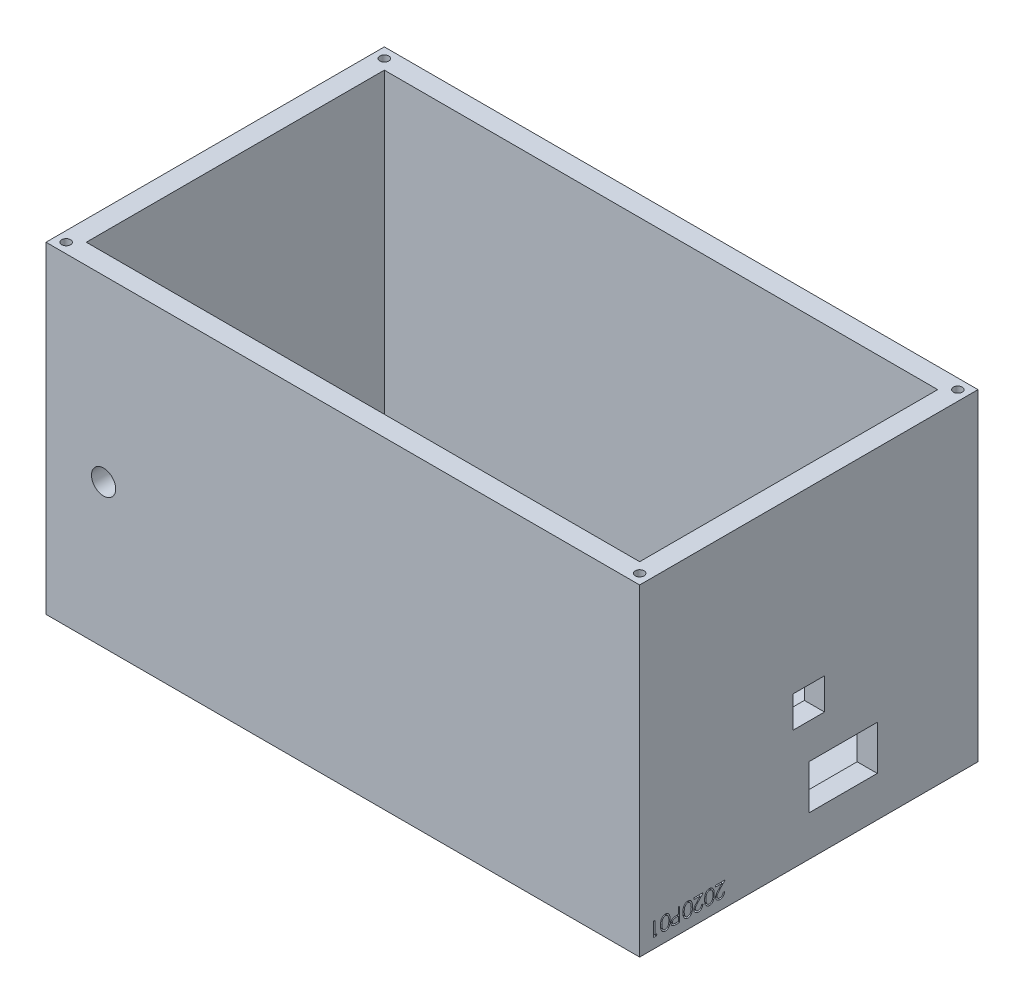
from build123d import *

# Parameters (mm, degrees)
SKETCH1_W                = 147.35
SKETCH1_H                = 83.98
PLATFORM_THICKNESS_DEPTH = 5
SKETCH2_W                = 147.35
SKETCH2_H                = 83.98
SKETCH2_W_2              = 137.35
SKETCH2_H_2              = 73.98
SIDE_THICKNESS_DEPTH     = 75
SKETCH5_R                = 1.1
MOUNTING_HOLES_1_DEPTH   = 5
SKETCH11_R               = 3
IO_HOLE_3_DEPTH          = 50
SKETCH6_W                = 7.8
SKETCH6_H                = 7.8
IO_HOLE_1_DEPTH          = 92
SKETCH10_W               = 17
SKETCH10_H               = 11
IO_HOLE_2_DEPTH          = 80
TEXT_1_DEPTH             = 1


with BuildPart() as part:
    # Sketch1 → platform_thickness (new body)
    with BuildSketch(Plane(origin=(0, 0, 0), x_dir=(1, 0, 0), z_dir=(0, 1, 0))):
        with Locations((-73.675, 41.99)):
            Rectangle(SKETCH1_W, SKETCH1_H)
    extrude(amount=PLATFORM_THICKNESS_DEPTH)

    # Sketch2 → side_thickness (add)
    with BuildSketch(Plane(origin=(0, 5, 0), x_dir=(1, 0, 0), z_dir=(0, 1, 0))):
        with Locations((-73.675, 41.99)):
            Rectangle(SKETCH2_W, SKETCH2_H)
        with Locations((-73.675, 41.99)):
            Rectangle(SKETCH2_W_2, SKETCH2_H_2, mode=Mode.SUBTRACT)
    extrude(amount=SIDE_THICKNESS_DEPTH)

    # Sketch5 → mounting_holes_1 (cut)
    with BuildSketch(Plane(origin=(0, 80, 0), x_dir=(1, 0, 0), z_dir=(0, 1, 0))):
        with Locations(Location((-144.85, 2.5, 0), (0, 0, 270))):
            Circle(SKETCH5_R)
        with Locations(Location((-144.85, 81.48, 0), (0, 0, 270))):
            Circle(SKETCH5_R)
        with Locations(Location((-2.5, 81.48, 0), (0, 0, 270))):
            Circle(SKETCH5_R)
        with Locations(Location((-2.5, 2.5, 0), (0, 0, 270))):
            Circle(SKETCH5_R)
    extrude(amount=-MOUNTING_HOLES_1_DEPTH, mode=Mode.SUBTRACT)

    # Sketch11 → io_hole_3 (cut)
    with BuildSketch(Plane.XY):
        with Locations((-133.06, 35.59)):
            Circle(SKETCH11_R)
    extrude(amount=-IO_HOLE_3_DEPTH, mode=Mode.SUBTRACT)

    # Sketch6 → io_hole_1 (cut)
    with BuildSketch(Plane(origin=(0, 0, 0), x_dir=(0, 0, -1), z_dir=(1, 0, 0))):
        with Locations((41.99, 33.64)):
            Rectangle(SKETCH6_W, SKETCH6_H)
    extrude(amount=-IO_HOLE_1_DEPTH, mode=Mode.SUBTRACT)

    # Sketch10 → io_hole_2 (cut)
    with BuildSketch(Plane(origin=(0, 0, 0), x_dir=(0, 0, -1), z_dir=(1, 0, 0))):
        with Locations((50.48, 15.5)):
            Rectangle(SKETCH10_W, SKETCH10_H)
    extrude(amount=-IO_HOLE_2_DEPTH, mode=Mode.SUBTRACT)

    # Sketch9 → text_1 (cut)
    # profile 1 of 7: a face of its own
    with BuildSketch(Plane(origin=(0, 0, 0), x_dir=(0, 0, -1), z_dir=(1, 0, 0))):
        Polygon((4.121494391, 2.5), (3.474358974, 2.5), (3.474358974, 6), (3.788461538, 6), (3.788461538, 2.858974359), (4.326923077, 2.858974359), align=None)
    # profile 2 of 7: a face of its own
    with BuildSketch(Plane(origin=(0, 0, 0), x_dir=(0, 0, -1), z_dir=(1, 0, 0))):
        with BuildLine():
            add(Edge.make_bspline(
                [(7.557692308, 4.251402244), (7.55736429, 4.195304856), (7.55672711, 4.086334872), (7.549638688, 3.92755023), (7.537863347, 3.77858994), (7.521725971, 3.639446877), (7.502088002, 3.510085102), (7.475872479, 3.390850379), (7.446059798, 3.281190657), (7.411506942, 3.180748998), (7.372520566, 3.088169955), (7.330081322, 3.001749477), (7.282534198, 2.921590798), (7.232494112, 2.846512877), (7.178209751, 2.777271277), (7.119869893, 2.714177181), (7.057988397, 2.656252852), (6.992272458, 2.604450783), (6.923348431, 2.559312189), (6.853255179, 2.518395075), (6.779993498, 2.48602851), (6.705370428, 2.458351368), (6.628784748, 2.436427331), (6.550203094, 2.421177443), (6.469554952, 2.411636788), (6.415124443, 2.410720902), (6.387520032, 2.41025641)],
                knots=[0, 0, 0, 0, 1.64625301, 3.197870201, 4.6634513, 6.030635694, 7.308242971, 8.501545196, 9.611429483, 10.641742253, 11.616230371, 12.55791849, 13.464870342, 14.34944951, 15.20427819, 16.044004467, 16.869007726, 17.689551165, 18.496129964, 19.285613293, 20.0683943, 20.843080271, 21.620342827, 22.403213977, 23.190190624, 24, 24, 24, 24], degree=3))
            add(Edge.make_bspline(
                [(6.387520032, 2.41025641), (6.359671054, 2.41064266), (6.30426139, 2.411411161), (6.222636242, 2.42222828), (6.142432865, 2.436190249), (6.064868102, 2.458582946), (5.988475353, 2.485378714), (5.915154352, 2.520735303), (5.84231648, 2.559188339), (5.773270665, 2.606097808), (5.705953943, 2.657940491), (5.642851545, 2.716795191), (5.582350404, 2.781033096), (5.526735625, 2.8520869), (5.473623636, 2.928867137), (5.425030622, 3.012017447), (5.379945936, 3.101353557), (5.337522106, 3.196461319), (5.300423587, 3.299881207), (5.267440038, 3.410968166), (5.240404439, 3.53072814), (5.218046474, 3.658493991), (5.200692436, 3.79489867), (5.188062462, 3.939665804), (5.181388618, 4.092885962), (5.180132024, 4.197643844), (5.179487179, 4.251402244)],
                knots=[0, 0, 0, 0, 0.810910589, 1.61342667, 2.396193133, 3.181089899, 3.963115317, 4.752255436, 5.550715454, 6.36105385, 7.181178335, 8.024612154, 8.872680183, 9.750181803, 10.651284446, 11.591556747, 12.554036451, 13.566402641, 14.62422919, 15.753422176, 16.94128843, 18.199818041, 19.531985927, 20.947085226, 22.433341622, 24, 24, 24, 24], degree=3))
            add(Edge.make_bspline(
                [(5.179487179, 4.251402244), (5.180147013, 4.304925484), (5.181435551, 4.409446778), (5.187910574, 4.561987465), (5.201031004, 4.705964641), (5.217022436, 4.841586903), (5.240078952, 4.96867697), (5.265747744, 5.087917363), (5.298489729, 5.198187676), (5.33470828, 5.300721073), (5.376541811, 5.39542595), (5.421286955, 5.48439331), (5.470605353, 5.567071724), (5.52269822, 5.644338633), (5.579365898, 5.714783062), (5.639048278, 5.779739545), (5.702762867, 5.838696497), (5.770426118, 5.891151303), (5.840124541, 5.938414137), (5.912976612, 5.978238292), (5.987276933, 6.012956828), (6.063798321, 6.040866471), (6.142052824, 6.062929153), (6.222322247, 6.07794821), (6.304272306, 6.088534754), (6.359674706, 6.089339249), (6.387520032, 6.08974359)],
                knots=[0, 0, 0, 0, 1.561431216, 3.049195289, 4.452146966, 5.778046447, 7.031138842, 8.218704273, 9.334037798, 10.384210803, 11.388620812, 12.352076869, 13.287433199, 14.19507451, 15.06813243, 15.922055533, 16.766344942, 17.596869952, 18.417486629, 19.220035357, 20.016159057, 20.807716045, 21.59340902, 22.384936649, 23.188266813, 24, 24, 24, 24], degree=3))
            add(Edge.make_bspline(
                [(6.387520032, 6.08974359), (6.41512348, 6.089274982), (6.469552093, 6.088350978), (6.550214132, 6.078869784), (6.628681846, 6.06340915), (6.705112102, 6.042413689), (6.779661299, 6.015729692), (6.851599224, 5.981788678), (6.921875657, 5.94242223), (6.99017096, 5.897636099), (7.055179528, 5.846310182), (7.117288889, 5.789553472), (7.174873373, 5.725903287), (7.228783368, 5.656375533), (7.279238651, 5.581108617), (7.326584425, 5.500336279), (7.368894428, 5.413073918), (7.408764773, 5.319992304), (7.443910788, 5.218812625), (7.474599639, 5.108777115), (7.500473132, 4.989135229), (7.521081731, 4.85988124), (7.537964769, 4.721215243), (7.54962708, 4.572916265), (7.556723565, 4.415301949), (7.557363501, 4.307032442), (7.557692308, 4.251402244)],
                knots=[0, 0, 0, 0, 0.810976328, 1.599087026, 2.383086309, 3.159618043, 3.926613167, 4.707144544, 5.494386734, 6.292609454, 7.104690378, 7.92621526, 8.762510248, 9.62398222, 10.509836085, 11.424023232, 12.373226806, 13.358118208, 14.398657954, 15.5185989, 16.713620699, 17.994156382, 19.364120462, 20.818119981, 22.365111093, 24, 24, 24, 24], degree=3))
        make_face()
        with BuildLine():
            add(Edge.make_bspline(
                [(7.243589744, 4.25), (7.243467677, 4.296748512), (7.243230771, 4.387478194), (7.237220863, 4.519091018), (7.228855685, 4.642052551), (7.218331807, 4.7563148), (7.202570816, 4.861478435), (7.184688966, 4.957980613), (7.163240918, 5.045642864), (7.137738438, 5.12523074), (7.108690165, 5.197872968), (7.077024971, 5.265499724), (7.042724722, 5.328933588), (7.005002469, 5.387945688), (6.96331776, 5.442206429), (6.918601011, 5.491973513), (6.870592209, 5.537044301), (6.804148123, 5.590534196), (6.716856262, 5.646459805), (6.606309848, 5.694561144), (6.492668356, 5.724985155), (6.415513557, 5.728843441), (6.377003205, 5.730769231)],
                knots=[0, 0, 0, 0, 1.459193451, 2.832007961, 4.111736495, 5.306635028, 6.412683014, 7.430020708, 8.369596877, 9.227877302, 10.036669781, 10.810175692, 11.557788084, 12.286326232, 12.994037279, 13.69140682, 14.37267704, 15.047194847, 16.352618509, 17.594157723, 18.799169539, 20, 20, 20, 20], degree=3))
            add(Edge.make_bspline(
                [(6.377003205, 5.730769231), (6.33827172, 5.729080577), (6.260946139, 5.725709259), (6.147381999, 5.696285725), (6.038045512, 5.648452404), (5.951758316, 5.593803968), (5.886294717, 5.541427275), (5.839373822, 5.496822595), (5.796312859, 5.446863957), (5.755470483, 5.392965431), (5.718011491, 5.334092732), (5.683948329, 5.270530218), (5.652864988, 5.202101023), (5.635155941, 5.154331286), (5.626101763, 5.129907853)],
                knots=[0, 0, 0, 0, 1.353621445, 2.702441307, 4.075953605, 5.516772412, 6.261413105, 7.007624062, 7.778524365, 8.566925914, 9.372323995, 10.217594641, 11.088702136, 12, 12, 12, 12], degree=3))
            add(Edge.make_bspline(
                [(5.626101763, 5.129907853), (5.615549995, 5.098678113), (5.594125381, 5.035268349), (5.566513607, 4.936904697), (5.544768208, 4.833701933), (5.525204842, 4.726276816), (5.511851786, 4.613837115), (5.501103973, 4.496730731), (5.494773286, 4.374869369), (5.493988535, 4.292074378), (5.493589744, 4.25)],
                knots=[0, 0, 0, 0, 0.884706709, 1.796334032, 2.740027952, 3.714592787, 4.726048262, 5.777819803, 6.87074269, 8, 8, 8, 8], degree=3))
            add(Edge.make_bspline(
                [(5.493589744, 4.25), (5.494029568, 4.207926527), (5.494890064, 4.125611637), (5.500543602, 4.00518488), (5.509628368, 3.890605538), (5.5219244, 3.781769669), (5.538804248, 3.678870986), (5.559075277, 3.581762255), (5.582840696, 3.490469608), (5.610100466, 3.404757773), (5.640821411, 3.324934256), (5.674760355, 3.250827224), (5.710972581, 3.182036982), (5.750330201, 3.11878479), (5.792276372, 3.060701568), (5.838317232, 3.009124356), (5.885528303, 2.961544065), (5.952672436, 2.908203054), (6.039861125, 2.853386358), (6.149101684, 2.80431297), (6.262160951, 2.775270014), (6.338750056, 2.771242399), (6.377003205, 2.769230769)],
                knots=[0, 0, 0, 0, 1.313528337, 2.569860077, 3.762944266, 4.901481389, 5.988248151, 7.017139294, 7.997571128, 8.932104357, 9.823695246, 10.66607014, 11.475539426, 12.248954257, 12.990316782, 13.708962568, 14.405488541, 15.08007697, 16.381737273, 17.610043218, 18.806313575, 20, 20, 20, 20], degree=3))
            add(Edge.make_bspline(
                [(6.377003205, 2.769230769), (6.415721305, 2.77124478), (6.493228041, 2.775276469), (6.607470038, 2.804210501), (6.717364559, 2.853037333), (6.804369513, 2.908270839), (6.870568393, 2.961336912), (6.917676699, 3.006627682), (6.962134646, 3.05592934), (7.003619663, 3.109944061), (7.041111761, 3.168843636), (7.075828898, 3.231817641), (7.107241457, 3.299343939), (7.136399376, 3.371946019), (7.161631261, 3.451664672), (7.184317667, 3.539309441), (7.201828159, 3.636439214), (7.217375937, 3.742096697), (7.229128289, 3.856494796), (7.237162562, 3.979747409), (7.243249025, 4.111819026), (7.243473896, 4.20301715), (7.243589744, 4.25)],
                knots=[0, 0, 0, 0, 1.207779899, 2.417760083, 3.652287919, 4.947299644, 5.621638849, 6.297435916, 6.984320042, 7.691843698, 8.42018894, 9.161205785, 9.934506883, 10.743085206, 11.601138371, 12.542248028, 13.566483018, 14.679455109, 15.87477181, 17.154161492, 18.533899613, 20, 20, 20, 20], degree=3))
        make_face(mode=Mode.SUBTRACT)
    # profile 3 of 7: a face of its own
    with BuildSketch(Plane(origin=(0, 0, 0), x_dir=(0, 0, -1), z_dir=(1, 0, 0))):
        with BuildLine():
            Line((9.935897436, 2.5), (9.249499199, 2.5))
            add(Edge.make_bspline(
                [(9.249499199, 2.5), (9.202288293, 2.500051896), (9.1118301, 2.500151332), (8.982115044, 2.503166078), (8.864305312, 2.50719277), (8.758654931, 2.512774663), (8.664838833, 2.519371253), (8.583281534, 2.528623292), (8.513341978, 2.538283588), (8.471435528, 2.548104995), (8.452323718, 2.552584135)],
                knots=[0, 0, 0, 0, 1.415646017, 2.712440637, 3.8905458, 4.950247383, 5.884950622, 6.709939814, 7.411656543, 8, 8, 8, 8], degree=3))
            add(Edge.make_bspline(
                [(8.452323718, 2.552584135), (8.428130338, 2.559206284), (8.380313664, 2.572294541), (8.311410397, 2.598505373), (8.245864809, 2.62959827), (8.183402726, 2.664982536), (8.125094196, 2.706329182), (8.069118714, 2.751251821), (8.016650168, 2.801567231), (7.968480816, 2.857209166), (7.923849831, 2.916354819), (7.886490497, 2.980512373), (7.853500735, 3.047456175), (7.827791514, 3.11882068), (7.807583078, 3.193663885), (7.792865252, 3.272180583), (7.783405791, 3.354201396), (7.782508207, 3.410263192), (7.782051282, 3.438802083)],
                knots=[0, 0, 0, 0, 0.999333726, 1.975119402, 2.933498163, 3.889020618, 4.832249799, 5.779334906, 6.747801194, 7.724875447, 8.710438469, 9.696133548, 10.679360639, 11.681339199, 12.714023775, 13.766351759, 14.862936069, 16, 16, 16, 16], degree=3))
            add(Edge.make_bspline(
                [(7.782051282, 3.438802083), (7.782472707, 3.46757986), (7.783297253, 3.523885524), (7.793193538, 3.606258312), (7.80652373, 3.684976702), (7.827020782, 3.759866153), (7.853866455, 3.830481923), (7.885358508, 3.897903155), (7.923342038, 3.960982827), (7.966986868, 4.019949945), (8.015538462, 4.074859857), (8.068791401, 4.125314652), (8.126530693, 4.17101899), (8.188572841, 4.212075334), (8.25552269, 4.247531613), (8.326364844, 4.279288918), (8.40171506, 4.305959979), (8.453857574, 4.31999004), (8.48036859, 4.327123397)],
                knots=[0, 0, 0, 0, 1.121902311, 2.195077645, 3.232258892, 4.234102512, 5.217864754, 6.176164875, 7.132989551, 8.084763148, 9.034132444, 9.988522005, 10.94243251, 11.903244335, 12.886203696, 13.894208494, 14.929344452, 16, 16, 16, 16], degree=3))
            add(Edge.make_bspline(
                [(8.48036859, 4.327123397), (8.502296173, 4.331782903), (8.550351748, 4.341994481), (8.629489508, 4.353472009), (8.72167613, 4.362884836), (8.826597955, 4.371668962), (8.944499658, 4.37632345), (9.075110829, 4.381788578), (9.218873501, 4.384367274), (9.319143482, 4.384530279), (9.371494391, 4.384615385)],
                knots=[0, 0, 0, 0, 0.601372724, 1.317943291, 2.144091499, 3.08771165, 4.142394186, 5.309582461, 6.595334295, 8, 8, 8, 8], degree=3))
            Line((9.371494391, 4.384615385), (9.621794872, 4.384615385))
            Line((9.621794872, 4.384615385), (9.621794872, 6))
            Line((9.621794872, 6), (9.935897436, 6))
            Line((9.935897436, 6), (9.935897436, 2.5))
        make_face()
        with BuildLine():
            Line((9.621794872, 2.858974359), (9.621794872, 4.025641026))
            Line((9.621794872, 4.025641026), (9.009014423, 4.033353365))
            add(Edge.make_bspline(
                [(9.009014423, 4.033353365), (8.979093994, 4.033373094), (8.921333221, 4.03341118), (8.837670722, 4.029357619), (8.760238091, 4.024947802), (8.688921003, 4.017816081), (8.624044967, 4.009117604), (8.56545291, 3.997487697), (8.512677238, 3.985625943), (8.45188551, 3.965043694), (8.383792399, 3.93399276), (8.309887259, 3.887614319), (8.246741377, 3.829189145), (8.192559178, 3.762788329), (8.14973185, 3.688842406), (8.118693028, 3.609944244), (8.099747576, 3.526393429), (8.097366294, 3.469282685), (8.096153846, 3.440204327)],
                knots=[0, 0, 0, 0, 1.160501667, 2.240324542, 3.248665471, 4.168823117, 5.020172044, 5.786515869, 6.485785279, 7.116517804, 8.272762037, 9.381837012, 10.485674779, 11.594342068, 12.695271952, 13.786226926, 14.872841088, 16, 16, 16, 16], degree=3))
            add(Edge.make_bspline(
                [(8.096153846, 3.440204327), (8.097420386, 3.412068028), (8.09993811, 3.356136547), (8.118536532, 3.274125119), (8.15006056, 3.196123905), (8.192594093, 3.122764074), (8.245477896, 3.056539741), (8.307367937, 2.99941665), (8.377301302, 2.953182197), (8.441846891, 2.922404362), (8.49961011, 2.904355554), (8.54954116, 2.891325229), (8.606205263, 2.88233849), (8.669066165, 2.873739872), (8.738043384, 2.866798916), (8.81357553, 2.861978894), (8.895411011, 2.859187578), (8.952221315, 2.859047153), (8.981670673, 2.858974359)],
                knots=[0, 0, 0, 0, 1.12039168, 2.227199994, 3.330242575, 4.460839274, 5.593542475, 6.693949254, 7.801736126, 8.92216649, 9.528704869, 10.210659466, 10.975987387, 11.81211542, 12.738540127, 13.736887663, 14.826846554, 16, 16, 16, 16], degree=3))
            Line((8.981670673, 2.858974359), (9.621794872, 2.858974359))
        make_face(mode=Mode.SUBTRACT)
    # profile 4 of 7: a face of its own
    with BuildSketch(Plane(origin=(0, 0, 0), x_dir=(0, 0, -1), z_dir=(1, 0, 0))):
        with BuildLine():
            add(Edge.make_bspline(
                [(13.121794872, 4.251402244), (13.121466854, 4.195304856), (13.120829674, 4.086334872), (13.113741252, 3.92755023), (13.101965911, 3.77858994), (13.085828535, 3.639446877), (13.066190566, 3.510085102), (13.039975043, 3.390850379), (13.010162362, 3.281190657), (12.975609506, 3.180748998), (12.93662313, 3.088169955), (12.894183886, 3.001749477), (12.846636763, 2.921590798), (12.796596676, 2.846512877), (12.742312316, 2.777271277), (12.683972457, 2.714177181), (12.622090961, 2.656252852), (12.556375022, 2.604450783), (12.487450995, 2.559312189), (12.417357743, 2.518395075), (12.344096062, 2.48602851), (12.269472992, 2.458351368), (12.192887312, 2.436427331), (12.114305658, 2.421177443), (12.033657516, 2.411636788), (11.979227007, 2.410720902), (11.951622596, 2.41025641)],
                knots=[0, 0, 0, 0, 1.64625301, 3.197870201, 4.6634513, 6.030635694, 7.308242971, 8.501545196, 9.611429483, 10.641742253, 11.616230371, 12.55791849, 13.464870342, 14.34944951, 15.20427819, 16.044004467, 16.869007726, 17.689551165, 18.496129964, 19.285613293, 20.0683943, 20.843080271, 21.620342827, 22.403213977, 23.190190624, 24, 24, 24, 24], degree=3))
            add(Edge.make_bspline(
                [(11.951622596, 2.41025641), (11.923773618, 2.41064266), (11.868363954, 2.411411161), (11.786738806, 2.42222828), (11.706535429, 2.436190249), (11.628970666, 2.458582946), (11.552577917, 2.485378714), (11.479256916, 2.520735303), (11.406419045, 2.559188339), (11.337373229, 2.606097808), (11.270056507, 2.657940491), (11.206954109, 2.716795191), (11.146452968, 2.781033096), (11.090838189, 2.8520869), (11.037726201, 2.928867137), (10.989133186, 3.012017447), (10.9440485, 3.101353557), (10.90162467, 3.196461319), (10.864526151, 3.299881207), (10.831542602, 3.410968166), (10.804507003, 3.53072814), (10.782149038, 3.658493991), (10.764795001, 3.79489867), (10.752165026, 3.939665804), (10.745491182, 4.092885962), (10.744234588, 4.197643844), (10.743589744, 4.251402244)],
                knots=[0, 0, 0, 0, 0.810910589, 1.61342667, 2.396193133, 3.181089899, 3.963115317, 4.752255436, 5.550715454, 6.36105385, 7.181178335, 8.024612154, 8.872680183, 9.750181803, 10.651284446, 11.591556747, 12.554036451, 13.566402641, 14.62422919, 15.753422176, 16.94128843, 18.199818041, 19.531985927, 20.947085226, 22.433341622, 24, 24, 24, 24], degree=3))
            add(Edge.make_bspline(
                [(10.743589744, 4.251402244), (10.744249577, 4.304925484), (10.745538115, 4.409446778), (10.752013138, 4.561987465), (10.765133569, 4.705964641), (10.781125, 4.841586903), (10.804181516, 4.96867697), (10.829850308, 5.087917363), (10.862592293, 5.198187676), (10.898810844, 5.300721073), (10.940644375, 5.39542595), (10.985389519, 5.48439331), (11.034707917, 5.567071724), (11.086800784, 5.644338633), (11.143468462, 5.714783062), (11.203150842, 5.779739545), (11.266865431, 5.838696497), (11.334528682, 5.891151303), (11.404227105, 5.938414137), (11.477079176, 5.978238292), (11.551379497, 6.012956828), (11.627900885, 6.040866471), (11.706155388, 6.062929153), (11.786424811, 6.07794821), (11.86837487, 6.088534754), (11.92377727, 6.089339249), (11.951622596, 6.08974359)],
                knots=[0, 0, 0, 0, 1.561431216, 3.049195289, 4.452146966, 5.778046447, 7.031138842, 8.218704273, 9.334037798, 10.384210803, 11.388620812, 12.352076869, 13.287433199, 14.19507451, 15.06813243, 15.922055533, 16.766344942, 17.596869952, 18.417486629, 19.220035357, 20.016159057, 20.807716045, 21.59340902, 22.384936649, 23.188266813, 24, 24, 24, 24], degree=3))
            add(Edge.make_bspline(
                [(11.951622596, 6.08974359), (11.979226045, 6.089274982), (12.033654657, 6.088350978), (12.114316696, 6.078869784), (12.19278441, 6.06340915), (12.269214667, 6.042413689), (12.343763863, 6.015729692), (12.415701788, 5.981788678), (12.485978222, 5.94242223), (12.554273524, 5.897636099), (12.619282092, 5.846310182), (12.681391453, 5.789553472), (12.738975937, 5.725903287), (12.792885932, 5.656375533), (12.843341215, 5.581108617), (12.890686989, 5.500336279), (12.932996992, 5.413073918), (12.972867338, 5.319992304), (13.008013352, 5.218812625), (13.038702203, 5.108777115), (13.064575696, 4.989135229), (13.085184295, 4.85988124), (13.102067333, 4.721215243), (13.113729644, 4.572916265), (13.12082613, 4.415301949), (13.121466065, 4.307032442), (13.121794872, 4.251402244)],
                knots=[0, 0, 0, 0, 0.810976328, 1.599087026, 2.383086309, 3.159618043, 3.926613167, 4.707144544, 5.494386734, 6.292609454, 7.104690378, 7.92621526, 8.762510248, 9.62398222, 10.509836085, 11.424023232, 12.373226806, 13.358118208, 14.398657954, 15.5185989, 16.713620699, 17.994156382, 19.364120462, 20.818119981, 22.365111093, 24, 24, 24, 24], degree=3))
        make_face()
        with BuildLine():
            add(Edge.make_bspline(
                [(12.807692308, 4.25), (12.807570241, 4.296748512), (12.807333335, 4.387478194), (12.801323427, 4.519091018), (12.79295825, 4.642052551), (12.782434371, 4.7563148), (12.76667338, 4.861478435), (12.74879153, 4.957980613), (12.727343482, 5.045642864), (12.701841002, 5.12523074), (12.672792729, 5.197872968), (12.641127535, 5.265499724), (12.606827287, 5.328933588), (12.569105034, 5.387945688), (12.527420324, 5.442206429), (12.482703575, 5.491973513), (12.434694773, 5.537044301), (12.368250687, 5.590534196), (12.280958826, 5.646459805), (12.170412413, 5.694561144), (12.05677092, 5.724985155), (11.979616121, 5.728843441), (11.941105769, 5.730769231)],
                knots=[0, 0, 0, 0, 1.459193451, 2.832007961, 4.111736495, 5.306635028, 6.412683014, 7.430020708, 8.369596877, 9.227877302, 10.036669781, 10.810175692, 11.557788084, 12.286326232, 12.994037279, 13.69140682, 14.37267704, 15.047194847, 16.352618509, 17.594157723, 18.799169539, 20, 20, 20, 20], degree=3))
            add(Edge.make_bspline(
                [(11.941105769, 5.730769231), (11.902374284, 5.729080577), (11.825048703, 5.725709259), (11.711484563, 5.696285725), (11.602148076, 5.648452404), (11.51586088, 5.593803968), (11.450397281, 5.541427275), (11.403476386, 5.496822595), (11.360415423, 5.446863957), (11.319573047, 5.392965431), (11.282114055, 5.334092732), (11.248050893, 5.270530218), (11.216967552, 5.202101023), (11.199258506, 5.154331286), (11.190204327, 5.129907853)],
                knots=[0, 0, 0, 0, 1.353621445, 2.702441307, 4.075953605, 5.516772412, 6.261413105, 7.007624062, 7.778524365, 8.566925914, 9.372323995, 10.217594641, 11.088702136, 12, 12, 12, 12], degree=3))
            add(Edge.make_bspline(
                [(11.190204327, 5.129907853), (11.179652559, 5.098678113), (11.158227945, 5.035268349), (11.130616171, 4.936904697), (11.108870772, 4.833701933), (11.089307406, 4.726276816), (11.07595435, 4.613837115), (11.065206537, 4.496730731), (11.05887585, 4.374869369), (11.058091099, 4.292074378), (11.057692308, 4.25)],
                knots=[0, 0, 0, 0, 0.884706709, 1.796334032, 2.740027952, 3.714592787, 4.726048262, 5.777819803, 6.87074269, 8, 8, 8, 8], degree=3))
            add(Edge.make_bspline(
                [(11.057692308, 4.25), (11.058132132, 4.207926527), (11.058992628, 4.125611637), (11.064646166, 4.00518488), (11.073730932, 3.890605538), (11.086026964, 3.781769669), (11.102906812, 3.678870986), (11.123177841, 3.581762255), (11.14694326, 3.490469608), (11.17420303, 3.404757773), (11.204923975, 3.324934256), (11.238862919, 3.250827224), (11.275075145, 3.182036982), (11.314432765, 3.11878479), (11.356378936, 3.060701568), (11.402419796, 3.009124356), (11.449630867, 2.961544065), (11.516775001, 2.908203054), (11.603963689, 2.853386358), (11.713204248, 2.80431297), (11.826263515, 2.775270014), (11.90285262, 2.771242399), (11.941105769, 2.769230769)],
                knots=[0, 0, 0, 0, 1.313528337, 2.569860077, 3.762944266, 4.901481389, 5.988248151, 7.017139294, 7.997571128, 8.932104357, 9.823695246, 10.66607014, 11.475539426, 12.248954257, 12.990316782, 13.708962568, 14.405488541, 15.08007697, 16.381737273, 17.610043218, 18.806313575, 20, 20, 20, 20], degree=3))
            add(Edge.make_bspline(
                [(11.941105769, 2.769230769), (11.979823869, 2.77124478), (12.057330605, 2.775276469), (12.171572602, 2.804210501), (12.281467123, 2.853037333), (12.368472077, 2.908270839), (12.434670957, 2.961336912), (12.481779263, 3.006627682), (12.52623721, 3.05592934), (12.567722227, 3.109944061), (12.605214325, 3.168843636), (12.639931462, 3.231817641), (12.671344021, 3.299343939), (12.70050194, 3.371946019), (12.725733825, 3.451664672), (12.748420231, 3.539309441), (12.765930723, 3.636439214), (12.781478501, 3.742096697), (12.793230854, 3.856494796), (12.801265126, 3.979747409), (12.807351589, 4.111819026), (12.80757646, 4.20301715), (12.807692308, 4.25)],
                knots=[0, 0, 0, 0, 1.207779899, 2.417760083, 3.652287919, 4.947299644, 5.621638849, 6.297435916, 6.984320042, 7.691843698, 8.42018894, 9.161205785, 9.934506883, 10.743085206, 11.601138371, 12.542248028, 13.566483018, 14.679455109, 15.87477181, 17.154161492, 18.533899613, 20, 20, 20, 20], degree=3))
        make_face(mode=Mode.SUBTRACT)
    # profile 5 of 7: a face of its own
    with BuildSketch(Plane(origin=(0, 0, 0), x_dir=(0, 0, -1), z_dir=(1, 0, 0))):
        with BuildLine():
            Line((15.365384615, 3.576923077), (15.679487179, 3.576923077))
            add(Edge.make_bspline(
                [(15.679487179, 3.576923077), (15.677440375, 3.535251984), (15.673420505, 3.453411066), (15.654587285, 3.334090066), (15.627664253, 3.220024748), (15.589508035, 3.112193012), (15.542388441, 3.009306717), (15.484700421, 2.912732075), (15.417673791, 2.821510594), (15.341431515, 2.737369399), (15.258701618, 2.660453826), (15.169979781, 2.593330411), (15.076177898, 2.53726656), (14.978109565, 2.4901436), (14.874640594, 2.454815045), (14.766760032, 2.428590323), (14.653980269, 2.412814818), (14.577140334, 2.411118916), (14.538060897, 2.41025641)],
                knots=[0, 0, 0, 0, 1.100776268, 2.161895295, 3.184016182, 4.190939212, 5.176500551, 6.166955529, 7.155448256, 8.160289653, 9.16017456, 10.133824356, 11.091467644, 12.04088621, 13.000931625, 13.972173743, 14.968683325, 16, 16, 16, 16], degree=3))
            add(Edge.make_bspline(
                [(14.538060897, 2.41025641), (14.499680123, 2.411147576), (14.424263271, 2.412898684), (14.314239464, 2.428162856), (14.209250364, 2.45155384), (14.110485814, 2.486215593), (14.01693221, 2.52970851), (13.929747902, 2.583797652), (13.846824682, 2.645923701), (13.772232277, 2.719204422), (13.703710155, 2.797395137), (13.644648228, 2.880902163), (13.593783632, 2.967250999), (13.552152549, 3.057116155), (13.520594337, 3.150790277), (13.497212726, 3.247375277), (13.483846534, 3.347985812), (13.481806432, 3.416094327), (13.480769231, 3.450721154)],
                knots=[0, 0, 0, 0, 1.111674182, 2.184400057, 3.212814286, 4.223731311, 5.211378316, 6.196328225, 7.191884489, 8.207283132, 9.220262353, 10.201199469, 11.166417575, 12.120932471, 13.06540007, 14.026332106, 14.996573967, 16, 16, 16, 16], degree=3))
            add(Edge.make_bspline(
                [(13.480769231, 3.450721154), (13.48246252, 3.499468967), (13.485819384, 3.596109139), (13.514533371, 3.73812431), (13.559381366, 3.875716558), (13.613373938, 3.986457634), (13.667857093, 4.075682681), (13.716905219, 4.149182446), (13.77465071, 4.228301108), (13.840600214, 4.313358897), (13.915889475, 4.40324191), (13.998562487, 4.499784002), (14.090754311, 4.601200043), (14.155402942, 4.670513692), (14.188902244, 4.706430288)],
                knots=[0, 0, 0, 0, 1.184416499, 2.348048165, 3.509039915, 4.696071444, 5.333504901, 6.05069495, 6.844171097, 7.714965912, 8.667477798, 9.695072654, 10.805644396, 12, 12, 12, 12], degree=3))
            Line((14.188902244, 4.706430288), (15.064603365, 5.641025641))
            Line((15.064603365, 5.641025641), (13.435897436, 5.641025641))
            Line((13.435897436, 5.641025641), (13.435897436, 6))
            Line((13.435897436, 6), (15.814102564, 6))
            Line((15.814102564, 6), (14.456730769, 4.551482372))
            add(Edge.make_bspline(
                [(14.456730769, 4.551482372), (14.423680543, 4.516985947), (14.360197821, 4.450725374), (14.270446028, 4.353957659), (14.189704818, 4.264290323), (14.117920634, 4.181326029), (14.05503441, 4.105535108), (14.001247354, 4.036323603), (13.956321739, 3.974285468), (13.908709949, 3.901405661), (13.863308947, 3.812318131), (13.823406112, 3.703996136), (13.799249479, 3.592240543), (13.796336865, 3.516742293), (13.794871795, 3.478766026)],
                knots=[0, 0, 0, 0, 1.329530082, 2.553755191, 3.672934919, 4.687409497, 5.60679272, 6.413407421, 7.126401618, 7.737995624, 8.834647426, 9.90044882, 10.943907757, 12, 12, 12, 12], degree=3))
            add(Edge.make_bspline(
                [(13.794871795, 3.478766026), (13.795501007, 3.454881988), (13.796741063, 3.407811137), (13.807892459, 3.338843243), (13.824276073, 3.272057712), (13.849528283, 3.2082803), (13.879867884, 3.146256628), (13.918628961, 3.08787241), (13.962922694, 3.031137467), (14.014301251, 2.977997193), (14.070705361, 2.92931245), (14.130301546, 2.886189289), (14.193351145, 2.850149937), (14.259591402, 2.820606504), (14.328836835, 2.797431106), (14.40122159, 2.781372531), (14.476545604, 2.771290046), (14.5279791, 2.769925874), (14.554186699, 2.769230769)],
                knots=[0, 0, 0, 0, 0.991504627, 1.954065223, 2.895985987, 3.842598665, 4.797835564, 5.759220273, 6.74786863, 7.784730864, 8.824135544, 9.839918996, 10.835834653, 11.835434876, 12.84861661, 13.863796685, 14.911511676, 16, 16, 16, 16], degree=3))
            add(Edge.make_bspline(
                [(14.554186699, 2.769230769), (14.581564523, 2.769917371), (14.63533005, 2.771265742), (14.714100114, 2.781485283), (14.789770135, 2.796962258), (14.861174057, 2.821601474), (14.929806239, 2.850438458), (14.993915838, 2.88777728), (15.055303774, 2.930442658), (15.112735824, 2.980187779), (15.165044011, 3.036342528), (15.212629236, 3.097465979), (15.25294867, 3.164641729), (15.288739824, 3.236257875), (15.316112991, 3.314282008), (15.339515087, 3.396805954), (15.35651403, 3.485007135), (15.362378643, 3.545775553), (15.365384615, 3.576923077)],
                knots=[0, 0, 0, 0, 1.031072318, 2.024855787, 2.988461151, 3.935103592, 4.865765533, 5.788564469, 6.724086513, 7.67908574, 8.64457978, 9.611397706, 10.591395687, 11.591555111, 12.622101007, 13.700900657, 14.821571223, 16, 16, 16, 16], degree=3))
        make_face()
    # profile 6 of 7: a face of its own
    with BuildSketch(Plane(origin=(0, 0, 0), x_dir=(0, 0, -1), z_dir=(1, 0, 0))):
        with BuildLine():
            add(Edge.make_bspline(
                [(18.506410256, 4.251402244), (18.506082238, 4.195304856), (18.505445058, 4.086334872), (18.498356637, 3.92755023), (18.486581296, 3.77858994), (18.47044392, 3.639446877), (18.45080595, 3.510085102), (18.424590427, 3.390850379), (18.394777747, 3.281190657), (18.360224891, 3.180748998), (18.321238515, 3.088169955), (18.27879927, 3.001749477), (18.231252147, 2.921590798), (18.18121206, 2.846512877), (18.1269277, 2.777271277), (18.068587841, 2.714177181), (18.006706345, 2.656252852), (17.940990406, 2.604450783), (17.872066379, 2.559312189), (17.801973127, 2.518395075), (17.728711447, 2.48602851), (17.654088377, 2.458351368), (17.577502697, 2.436427331), (17.498921043, 2.421177443), (17.418272901, 2.411636788), (17.363842391, 2.410720902), (17.336237981, 2.41025641)],
                knots=[0, 0, 0, 0, 1.64625301, 3.197870201, 4.6634513, 6.030635694, 7.308242971, 8.501545196, 9.611429483, 10.641742253, 11.616230371, 12.55791849, 13.464870342, 14.34944951, 15.20427819, 16.044004467, 16.869007726, 17.689551165, 18.496129964, 19.285613293, 20.0683943, 20.843080271, 21.620342827, 22.403213977, 23.190190624, 24, 24, 24, 24], degree=3))
            add(Edge.make_bspline(
                [(17.336237981, 2.41025641), (17.308389003, 2.41064266), (17.252979339, 2.411411161), (17.171354191, 2.42222828), (17.091150813, 2.436190249), (17.01358605, 2.458582946), (16.937193301, 2.485378714), (16.863872301, 2.520735303), (16.791034429, 2.559188339), (16.721988614, 2.606097808), (16.654671892, 2.657940491), (16.591569494, 2.716795191), (16.531068353, 2.781033096), (16.475453574, 2.8520869), (16.422341585, 2.928867137), (16.373748571, 3.012017447), (16.328663885, 3.101353557), (16.286240055, 3.196461319), (16.249141536, 3.299881207), (16.216157987, 3.410968166), (16.189122387, 3.53072814), (16.166764422, 3.658493991), (16.149410385, 3.79489867), (16.13678041, 3.939665804), (16.130106566, 4.092885962), (16.128849972, 4.197643844), (16.128205128, 4.251402244)],
                knots=[0, 0, 0, 0, 0.810910589, 1.61342667, 2.396193133, 3.181089899, 3.963115317, 4.752255436, 5.550715454, 6.36105385, 7.181178335, 8.024612154, 8.872680183, 9.750181803, 10.651284446, 11.591556747, 12.554036451, 13.566402641, 14.62422919, 15.753422176, 16.94128843, 18.199818041, 19.531985927, 20.947085226, 22.433341622, 24, 24, 24, 24], degree=3))
            add(Edge.make_bspline(
                [(16.128205128, 4.251402244), (16.128864962, 4.304925484), (16.130153499, 4.409446778), (16.136628523, 4.561987465), (16.149748953, 4.705964641), (16.165740385, 4.841586903), (16.188796901, 4.96867697), (16.214465693, 5.087917363), (16.247207678, 5.198187676), (16.283426229, 5.300721073), (16.32525976, 5.39542595), (16.370004904, 5.48439331), (16.419323302, 5.567071724), (16.471416169, 5.644338633), (16.528083847, 5.714783062), (16.587766227, 5.779739545), (16.651480816, 5.838696497), (16.719144067, 5.891151303), (16.78884249, 5.938414137), (16.861694561, 5.978238292), (16.935994881, 6.012956828), (17.01251627, 6.040866471), (17.090770772, 6.062929153), (17.171040196, 6.07794821), (17.252990255, 6.088534754), (17.308392654, 6.089339249), (17.336237981, 6.08974359)],
                knots=[0, 0, 0, 0, 1.561431216, 3.049195289, 4.452146966, 5.778046447, 7.031138842, 8.218704273, 9.334037798, 10.384210803, 11.388620812, 12.352076869, 13.287433199, 14.19507451, 15.06813243, 15.922055533, 16.766344942, 17.596869952, 18.417486629, 19.220035357, 20.016159057, 20.807716045, 21.59340902, 22.384936649, 23.188266813, 24, 24, 24, 24], degree=3))
            add(Edge.make_bspline(
                [(17.336237981, 6.08974359), (17.363841429, 6.089274982), (17.418270042, 6.088350978), (17.498932081, 6.078869784), (17.577399795, 6.06340915), (17.653830051, 6.042413689), (17.728379248, 6.015729692), (17.800317173, 5.981788678), (17.870593606, 5.94242223), (17.938888908, 5.897636099), (18.003897477, 5.846310182), (18.066006838, 5.789553472), (18.123591322, 5.725903287), (18.177501316, 5.656375533), (18.2279566, 5.581108617), (18.275302374, 5.500336279), (18.317612376, 5.413073918), (18.357482722, 5.319992304), (18.392628737, 5.218812625), (18.423317587, 5.108777115), (18.449191081, 4.989135229), (18.46979968, 4.85988124), (18.486682718, 4.721215243), (18.498345029, 4.572916265), (18.505441514, 4.415301949), (18.50608145, 4.307032442), (18.506410256, 4.251402244)],
                knots=[0, 0, 0, 0, 0.810976328, 1.599087026, 2.383086309, 3.159618043, 3.926613167, 4.707144544, 5.494386734, 6.292609454, 7.104690378, 7.92621526, 8.762510248, 9.62398222, 10.509836085, 11.424023232, 12.373226806, 13.358118208, 14.398657954, 15.5185989, 16.713620699, 17.994156382, 19.364120462, 20.818119981, 22.365111093, 24, 24, 24, 24], degree=3))
        make_face()
        with BuildLine():
            add(Edge.make_bspline(
                [(18.192307692, 4.25), (18.192185626, 4.296748512), (18.191948719, 4.387478194), (18.185938812, 4.519091018), (18.177573634, 4.642052551), (18.167049756, 4.7563148), (18.151288764, 4.861478435), (18.133406915, 4.957980613), (18.111958867, 5.045642864), (18.086456386, 5.12523074), (18.057408113, 5.197872968), (18.02574292, 5.265499724), (17.991442671, 5.328933588), (17.953720418, 5.387945688), (17.912035709, 5.442206429), (17.86731896, 5.491973513), (17.819310158, 5.537044301), (17.752866071, 5.590534196), (17.66557421, 5.646459805), (17.555027797, 5.694561144), (17.441386305, 5.724985155), (17.364231506, 5.728843441), (17.325721154, 5.730769231)],
                knots=[0, 0, 0, 0, 1.459193451, 2.832007961, 4.111736495, 5.306635028, 6.412683014, 7.430020708, 8.369596877, 9.227877302, 10.036669781, 10.810175692, 11.557788084, 12.286326232, 12.994037279, 13.69140682, 14.37267704, 15.047194847, 16.352618509, 17.594157723, 18.799169539, 20, 20, 20, 20], degree=3))
            add(Edge.make_bspline(
                [(17.325721154, 5.730769231), (17.286989669, 5.729080577), (17.209664088, 5.725709259), (17.096099947, 5.696285725), (16.986763461, 5.648452404), (16.900476265, 5.593803968), (16.835012666, 5.541427275), (16.788091771, 5.496822595), (16.745030808, 5.446863957), (16.704188431, 5.392965431), (16.66672944, 5.334092732), (16.632666278, 5.270530218), (16.601582937, 5.202101023), (16.58387389, 5.154331286), (16.574819712, 5.129907853)],
                knots=[0, 0, 0, 0, 1.353621445, 2.702441307, 4.075953605, 5.516772412, 6.261413105, 7.007624062, 7.778524365, 8.566925914, 9.372323995, 10.217594641, 11.088702136, 12, 12, 12, 12], degree=3))
            add(Edge.make_bspline(
                [(16.574819712, 5.129907853), (16.564267944, 5.098678113), (16.54284333, 5.035268349), (16.515231556, 4.936904697), (16.493486156, 4.833701933), (16.473922791, 4.726276816), (16.460569735, 4.613837115), (16.449821922, 4.496730731), (16.443491235, 4.374869369), (16.442706483, 4.292074378), (16.442307692, 4.25)],
                knots=[0, 0, 0, 0, 0.884706709, 1.796334032, 2.740027952, 3.714592787, 4.726048262, 5.777819803, 6.87074269, 8, 8, 8, 8], degree=3))
            add(Edge.make_bspline(
                [(16.442307692, 4.25), (16.442747516, 4.207926527), (16.443608013, 4.125611637), (16.449261551, 4.00518488), (16.458346316, 3.890605538), (16.470642349, 3.781769669), (16.487522197, 3.678870986), (16.507793226, 3.581762255), (16.531558644, 3.490469608), (16.558818415, 3.404757773), (16.58953936, 3.324934256), (16.623478304, 3.250827224), (16.65969053, 3.182036982), (16.69904815, 3.11878479), (16.74099432, 3.060701568), (16.78703518, 3.009124356), (16.834246251, 2.961544065), (16.901390385, 2.908203054), (16.988579074, 2.853386358), (17.097819632, 2.80431297), (17.2108789, 2.775270014), (17.287468004, 2.771242399), (17.325721154, 2.769230769)],
                knots=[0, 0, 0, 0, 1.313528337, 2.569860077, 3.762944266, 4.901481389, 5.988248151, 7.017139294, 7.997571128, 8.932104357, 9.823695246, 10.66607014, 11.475539426, 12.248954257, 12.990316782, 13.708962568, 14.405488541, 15.08007697, 16.381737273, 17.610043218, 18.806313575, 20, 20, 20, 20], degree=3))
            add(Edge.make_bspline(
                [(17.325721154, 2.769230769), (17.364439254, 2.77124478), (17.44194599, 2.775276469), (17.556187986, 2.804210501), (17.666082508, 2.853037333), (17.753087461, 2.908270839), (17.819286342, 2.961336912), (17.866394648, 3.006627682), (17.910852594, 3.05592934), (17.952337612, 3.109944061), (17.98982971, 3.168843636), (18.024546847, 3.231817641), (18.055959406, 3.299343939), (18.085117325, 3.371946019), (18.11034921, 3.451664672), (18.133035616, 3.539309441), (18.150546108, 3.636439214), (18.166093886, 3.742096697), (18.177846238, 3.856494796), (18.185880511, 3.979747409), (18.191966973, 4.111819026), (18.192191845, 4.20301715), (18.192307692, 4.25)],
                knots=[0, 0, 0, 0, 1.207779899, 2.417760083, 3.652287919, 4.947299644, 5.621638849, 6.297435916, 6.984320042, 7.691843698, 8.42018894, 9.161205785, 9.934506883, 10.743085206, 11.601138371, 12.542248028, 13.566483018, 14.679455109, 15.87477181, 17.154161492, 18.533899613, 20, 20, 20, 20], degree=3))
        make_face(mode=Mode.SUBTRACT)
    # profile 7 of 7: a face of its own
    with BuildSketch(Plane(origin=(0, 0, 0), x_dir=(0, 0, -1), z_dir=(1, 0, 0))):
        with BuildLine():
            Line((20.75, 3.576923077), (21.064102564, 3.576923077))
            add(Edge.make_bspline(
                [(21.064102564, 3.576923077), (21.06205576, 3.535251984), (21.05803589, 3.453411066), (21.03920267, 3.334090066), (21.012279638, 3.220024748), (20.97412342, 3.112193012), (20.927003825, 3.009306717), (20.869315806, 2.912732075), (20.802289176, 2.821510594), (20.726046899, 2.737369399), (20.643317002, 2.660453826), (20.554595166, 2.593330411), (20.460793283, 2.53726656), (20.36272495, 2.4901436), (20.259255979, 2.454815045), (20.151375416, 2.428590323), (20.038595654, 2.412814818), (19.961755718, 2.411118916), (19.922676282, 2.41025641)],
                knots=[0, 0, 0, 0, 1.100776268, 2.161895295, 3.184016182, 4.190939212, 5.176500551, 6.166955529, 7.155448256, 8.160289653, 9.16017456, 10.133824356, 11.091467644, 12.04088621, 13.000931625, 13.972173743, 14.968683325, 16, 16, 16, 16], degree=3))
            add(Edge.make_bspline(
                [(19.922676282, 2.41025641), (19.884295507, 2.411147576), (19.808878656, 2.412898684), (19.698854848, 2.428162856), (19.593865749, 2.45155384), (19.495101199, 2.486215593), (19.401547595, 2.52970851), (19.314363287, 2.583797652), (19.231440067, 2.645923701), (19.156847662, 2.719204422), (19.088325539, 2.797395137), (19.029263613, 2.880902163), (18.978399017, 2.967250999), (18.936767934, 3.057116155), (18.905209722, 3.150790277), (18.881828111, 3.247375277), (18.868461919, 3.347985812), (18.866421817, 3.416094327), (18.865384615, 3.450721154)],
                knots=[0, 0, 0, 0, 1.111674182, 2.184400057, 3.212814286, 4.223731311, 5.211378316, 6.196328225, 7.191884489, 8.207283132, 9.220262353, 10.201199469, 11.166417575, 12.120932471, 13.06540007, 14.026332106, 14.996573967, 16, 16, 16, 16], degree=3))
            add(Edge.make_bspline(
                [(18.865384615, 3.450721154), (18.867077905, 3.499468967), (18.870434769, 3.596109139), (18.899148755, 3.73812431), (18.943996751, 3.875716558), (18.997989323, 3.986457634), (19.052472477, 4.075682681), (19.101520604, 4.149182446), (19.159266095, 4.228301108), (19.225215599, 4.313358897), (19.300504859, 4.40324191), (19.383177872, 4.499784002), (19.475369695, 4.601200043), (19.540018327, 4.670513692), (19.573517628, 4.706430288)],
                knots=[0, 0, 0, 0, 1.184416499, 2.348048165, 3.509039915, 4.696071444, 5.333504901, 6.05069495, 6.844171097, 7.714965912, 8.667477798, 9.695072654, 10.805644396, 12, 12, 12, 12], degree=3))
            Line((19.573517628, 4.706430288), (20.44921875, 5.641025641))
            Line((20.44921875, 5.641025641), (18.820512821, 5.641025641))
            Line((18.820512821, 5.641025641), (18.820512821, 6))
            Line((18.820512821, 6), (21.198717949, 6))
            Line((21.198717949, 6), (19.841346154, 4.551482372))
            add(Edge.make_bspline(
                [(19.841346154, 4.551482372), (19.808295927, 4.516985947), (19.744813206, 4.450725374), (19.655061412, 4.353957659), (19.574320203, 4.264290323), (19.502536018, 4.181326029), (19.439649794, 4.105535108), (19.385862739, 4.036323603), (19.340937124, 3.974285468), (19.293325333, 3.901405661), (19.247924332, 3.812318131), (19.208021497, 3.703996136), (19.183864863, 3.592240543), (19.180952249, 3.516742293), (19.179487179, 3.478766026)],
                knots=[0, 0, 0, 0, 1.329530082, 2.553755191, 3.672934919, 4.687409497, 5.60679272, 6.413407421, 7.126401618, 7.737995624, 8.834647426, 9.90044882, 10.943907757, 12, 12, 12, 12], degree=3))
            add(Edge.make_bspline(
                [(19.179487179, 3.478766026), (19.180116391, 3.454881988), (19.181356447, 3.407811137), (19.192507843, 3.338843243), (19.208891457, 3.272057712), (19.234143668, 3.2082803), (19.264483268, 3.146256628), (19.303244346, 3.08787241), (19.347538078, 3.031137467), (19.398916636, 2.977997193), (19.455320745, 2.92931245), (19.51491693, 2.886189289), (19.577966529, 2.850149937), (19.644206787, 2.820606504), (19.71345222, 2.797431106), (19.785836975, 2.781372531), (19.861160988, 2.771290046), (19.912594484, 2.769925874), (19.938802083, 2.769230769)],
                knots=[0, 0, 0, 0, 0.991504627, 1.954065223, 2.895985987, 3.842598665, 4.797835564, 5.759220273, 6.74786863, 7.784730864, 8.824135544, 9.839918996, 10.835834653, 11.835434876, 12.84861661, 13.863796685, 14.911511676, 16, 16, 16, 16], degree=3))
            add(Edge.make_bspline(
                [(19.938802083, 2.769230769), (19.966179908, 2.769917371), (20.019945434, 2.771265742), (20.098715499, 2.781485283), (20.174385519, 2.796962258), (20.245789442, 2.821601474), (20.314421623, 2.850438458), (20.378531223, 2.88777728), (20.439919159, 2.930442658), (20.497351209, 2.980187779), (20.549659395, 3.036342528), (20.597244621, 3.097465979), (20.637564054, 3.164641729), (20.673355208, 3.236257875), (20.700728375, 3.314282008), (20.724130471, 3.396805954), (20.741129415, 3.485007135), (20.746994028, 3.545775553), (20.75, 3.576923077)],
                knots=[0, 0, 0, 0, 1.031072318, 2.024855787, 2.988461151, 3.935103592, 4.865765533, 5.788564469, 6.724086513, 7.67908574, 8.64457978, 9.611397706, 10.591395687, 11.591555111, 12.622101007, 13.700900657, 14.821571223, 16, 16, 16, 16], degree=3))
        make_face()
    extrude(amount=-TEXT_1_DEPTH, mode=Mode.SUBTRACT)


solid = part.part
